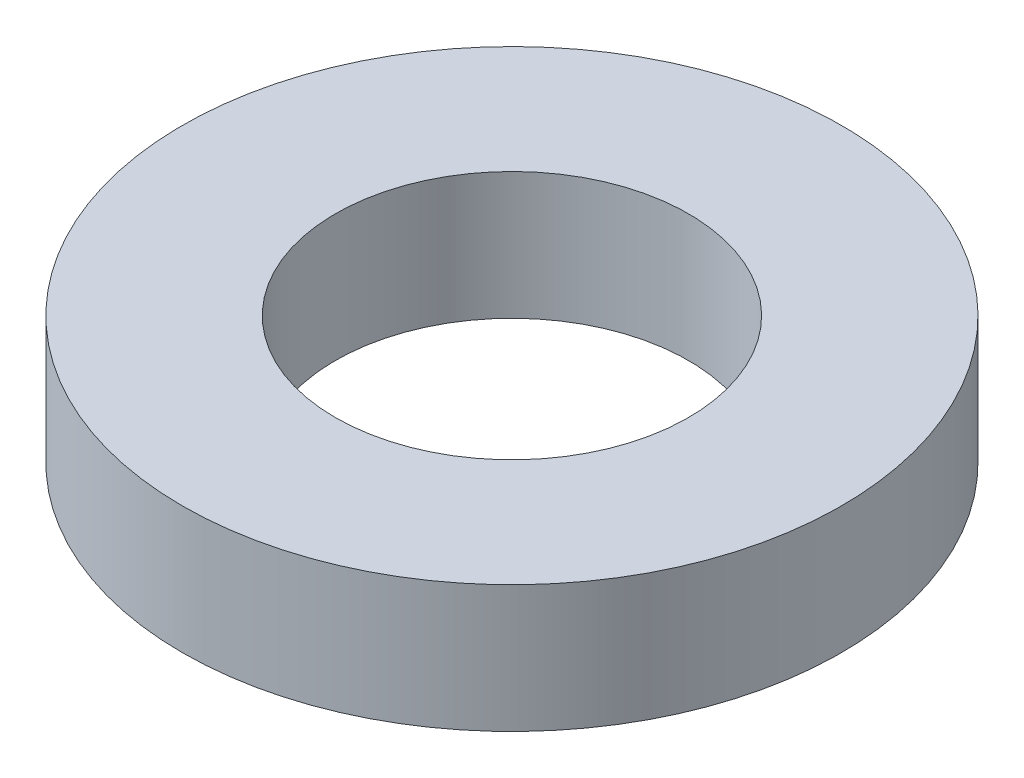
from build123d import *

# Parameters (mm, degrees)
SKETCH1_R           = 8.89
BOSS_EXTRUDE1_DEPTH = 3.429
SKETCH2_R           = 4.7625
CUT_EXTRUDE1_DEPTH  = 3.429


with BuildPart() as part:
    # Sketch1 → Boss-Extrude1 (new body)
    with BuildSketch(Plane(origin=(0, 0, 0), x_dir=(1, 0, 0), z_dir=(0, 1, 0))):
        with Locations(Location((0, 0, 0), (0, 0, 270))):
            Circle(SKETCH1_R)
    extrude(amount=BOSS_EXTRUDE1_DEPTH)

    # Sketch2 → Cut-Extrude1 (cut)
    with BuildSketch(Plane(origin=(0, 3.429, 0), x_dir=(1, 0, 0), z_dir=(0, 1, 0))):
        with Locations(Location((0, 0, 0), (0, 0, 270))):
            Circle(SKETCH2_R)
    extrude(amount=-CUT_EXTRUDE1_DEPTH, mode=Mode.SUBTRACT)


solid = part.part
